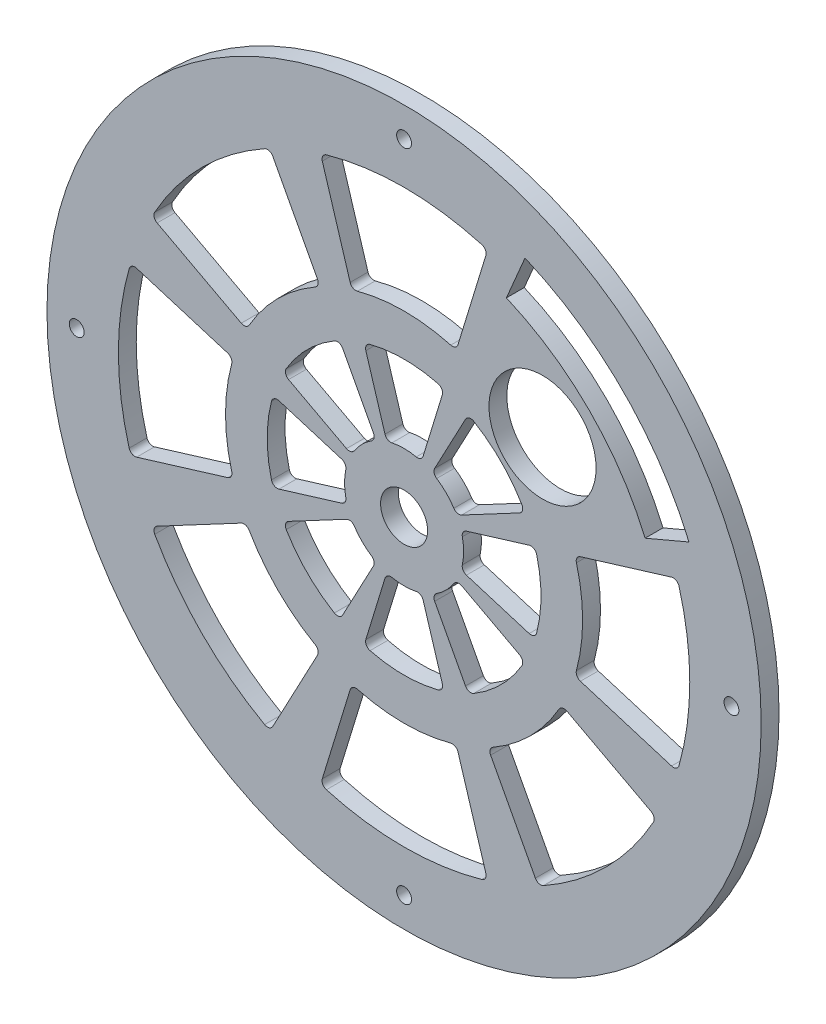
from build123d import *

# Parameters (mm, degrees)
SKETCH_1_R               = 60
SKETCH_1_R_2             = 3.95
SKETCH_1_R_3             = 9
SKETCH_1_R_4             = 1.25
EXTRUDE_1_DEPTH          = 3
CUT_EXTRUDE_2_DEPTH      = 85.905830189
PATTERN_CIRCULAR_1_COUNT = 8
CUT_EXTRUDE_3_DEPTH      = 85.905830189
PATTERN_CIRCULAR_2_COUNT = 4
PATTERN_CIRCULAR_2_ANGLE = 135
PATTERN_CIRCULAR_3_COUNT = 4
PATTERN_CIRCULAR_3_ANGLE = 135
CUT_EXTRUDE_6_DEPTH      = 85.905830189


with BuildPart() as part:
    # 草图1 → 凸台-拉伸1 (new body)
    with BuildSketch(Plane.XY):
        Circle(SKETCH_1_R)
        Circle(SKETCH_1_R_2, mode=Mode.SUBTRACT)
        with Locations((23.263813101, 23.263813101)):
            Circle(SKETCH_1_R_3, mode=Mode.SUBTRACT)
        with Locations((0, 55)):
            Circle(SKETCH_1_R_4, mode=Mode.SUBTRACT)
        with Locations(Location((0, -55, 0), (0, 0, 180))):
            Circle(SKETCH_1_R_4, mode=Mode.SUBTRACT)
        with Locations((-55, 0)):
            Circle(SKETCH_1_R_4, mode=Mode.SUBTRACT)
        with Locations(Location((55, 0, 0), (0, 0, 180))):
            Circle(SKETCH_1_R_4, mode=Mode.SUBTRACT)
    extrude(amount=EXTRUDE_1_DEPTH)

    # 草图2 → 切除-拉伸2 (cut, through all)
    with BuildSketch(Plane(origin=(0, 0, 0), x_dir=(-1, 0, 0), z_dir=(0, 0, -1))):
        with BuildLine():
            Line((5.142803301, -9.672206274), (10.317699056, -19.404769676))
            ThreePointArc((10.317699056, -19.404769676), (10.930090319, -19.898002259), (11.709766951, -19.795993482))
            ThreePointArc((11.709766951, -19.795993482), (16.263455967, -16.263455967), (19.795993482, -11.709766951))
            ThreePointArc((19.795993482, -11.709766951), (19.898002259, -10.930090319), (19.404769676, -10.317699056))
            Line((19.404769676, -10.317699056), (9.672206274, -5.142803301))
            ThreePointArc((9.672206274, -5.142803301), (8.954179293, -5.057133217), (8.366122465, -5.477955358))
            ThreePointArc((8.366122465, -5.477955358), (7.071067812, -7.071067812), (5.477955358, -8.366122465))
            ThreePointArc((5.477955358, -8.366122465), (5.057133217, -8.954179293), (5.142803301, -9.672206274))
        make_face()
    cut_extrude_2 = extrude(amount=-CUT_EXTRUDE_2_DEPTH, mode=Mode.SUBTRACT)

    # 阵列(圆周)1: 切除-拉伸2 ×8 about axis
    pattern_circular_1_axis = Axis((0, 0, 0), (0, 0, 1))
    for i in range(1, PATTERN_CIRCULAR_1_COUNT):
        add(cut_extrude_2.rotate(pattern_circular_1_axis, i * 360 / PATTERN_CIRCULAR_1_COUNT), mode=Mode.SUBTRACT)

    # 草图3 → 切除-拉伸3 (cut, through all)
    with BuildSketch(Plane(origin=(0, 0, 0), x_dir=(-1, 0, 0), z_dir=(0, 0, -1))):
        with BuildLine():
            Line((14.546044354, -27.357130582), (22.060168507, -41.489142742))
            ThreePointArc((22.060168507, -41.489142742), (22.660934973, -41.979032326), (23.431267506, -41.89243014))
            ThreePointArc((23.431267506, -41.89243014), (33.941125497, -33.941125497), (41.89243014, -23.431267506))
            ThreePointArc((41.89243014, -23.431267506), (41.979032326, -22.660934973), (41.489142742, -22.060168507))
            Line((41.489142742, -22.060168507), (27.357130582, -14.546044354))
            ThreePointArc((27.357130582, -14.546044354), (26.610751634, -14.468095334), (26.02031518, -14.931282529))
            ThreePointArc((26.02031518, -14.931282529), (21.213203436, -21.213203436), (14.931282529, -26.02031518))
            ThreePointArc((14.931282529, -26.02031518), (14.468095334, -26.610751634), (14.546044354, -27.357130582))
        make_face()
    cut_extrude_3 = extrude(amount=-CUT_EXTRUDE_3_DEPTH, mode=Mode.SUBTRACT)

    # 阵列(圆周)2: 切除-拉伸3 ×4 about axis
    pattern_circular_2_axis = Axis((0, 0, 0), (0, 0, 1))
    for i in range(1, PATTERN_CIRCULAR_2_COUNT):
        add(cut_extrude_3.rotate(pattern_circular_2_axis, i * PATTERN_CIRCULAR_2_ANGLE / (PATTERN_CIRCULAR_2_COUNT - 1)), mode=Mode.SUBTRACT)

    # 阵列(圆周)3: 切除-拉伸3 ×4 about axis
    pattern_circular_3_axis = Axis((0, 0, 0), (0, 0, -1))
    for i in range(1, PATTERN_CIRCULAR_3_COUNT):
        add(cut_extrude_3.rotate(pattern_circular_3_axis, i * PATTERN_CIRCULAR_3_ANGLE / (PATTERN_CIRCULAR_3_COUNT - 1)), mode=Mode.SUBTRACT)

    # 草图4 → 切除-拉伸6 (cut, through all)
    with BuildSketch(Plane(origin=(0, 0, 0), x_dir=(-1, 0, 0), z_dir=(0, 0, -1))):
        with BuildLine():
            Line((-47.86625238, 20.318018681), (-40.502213552, 17.192169654))
            ThreePointArc((-40.502213552, 17.192169654), (-31.112698372, 31.112698372), (-17.192169654, 40.502213552))
            Line((-17.192169654, 40.502213552), (-20.318018681, 47.86625238))
            ThreePointArc((-20.318018681, 47.86625238), (-36.769552622, 36.769552622), (-47.86625238, 20.318018681))
        make_face()
    extrude(amount=-CUT_EXTRUDE_6_DEPTH, mode=Mode.SUBTRACT)


solid = part.part
